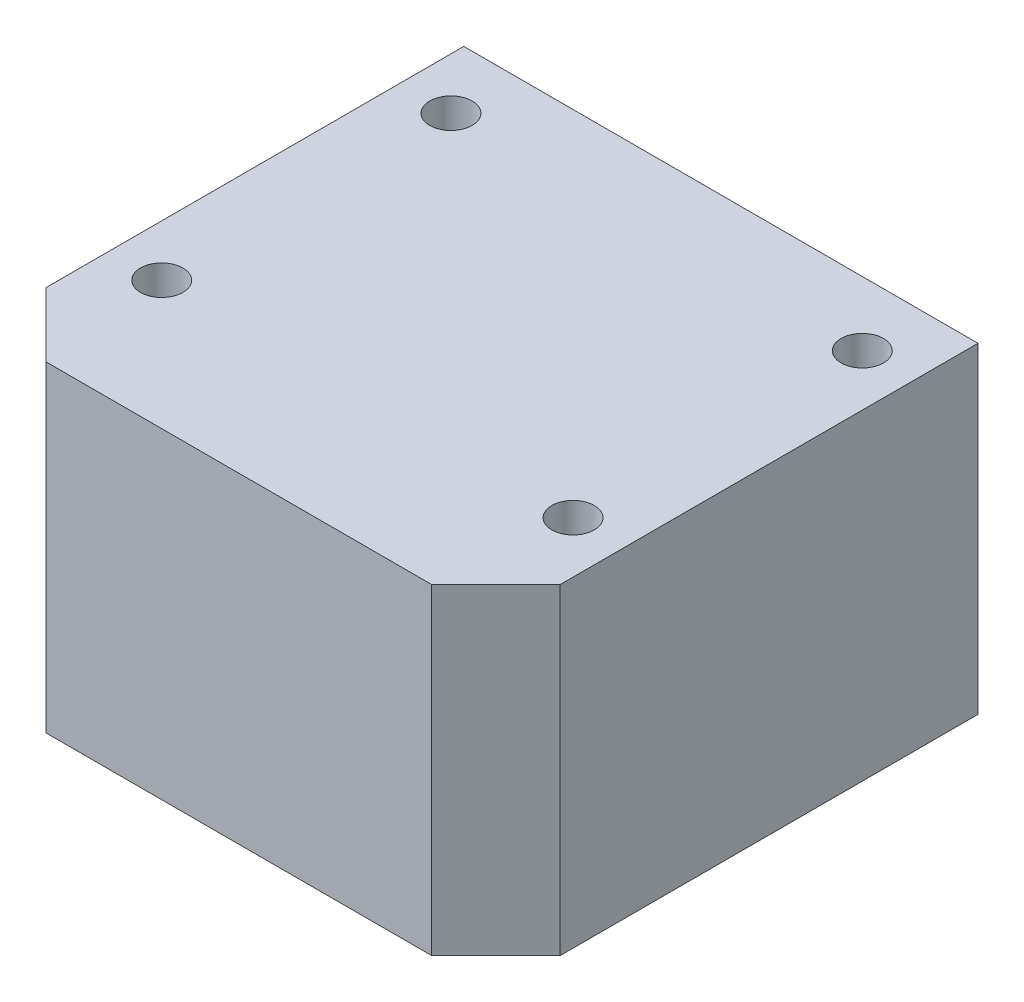
from build123d import *

# Parameters (mm, degrees)
SKETCH2_W             = 40
SKETCH2_H             = 32.5
BOSS_EXTRUDE1_DEPTH   = 25
SKETCH3_W             = 40
SKETCH3_H             = 5
BOSS_EXTRUDE2_DEPTH   = 25
SKETCH1_R             = 14
CUT_EXTRUDE1_DEPTH    = 9
CHAMFER1_SIZE         = 1
M4_TAPPED_HOLE2_D     = 3.3
M4_TAPPED_HOLE2_DEPTH = 10
M4_TAPPED_HOLE2_TIP   = 0.991420021
CHAMFER2_SIZE         = 5
M4_TAPPED_HOLE3_D     = 3.3
M4_TAPPED_HOLE3_DEPTH = 12.1
M4_TAPPED_HOLE3_TIP   = 0.991420021


with BuildPart() as part:
    # Sketch2 → Boss-Extrude1 (new body)
    with BuildSketch(Plane(origin=(0, 0, 0), x_dir=(1, 0, 0), z_dir=(0, 1, 0))):
        with Locations((0, 3.75)):
            Rectangle(SKETCH2_W, SKETCH2_H)
    extrude(amount=BOSS_EXTRUDE1_DEPTH)

    # Sketch3 → Boss-Extrude2 (add)
    with BuildSketch(Plane.XZ):
        with Locations((0, 15)):
            Rectangle(SKETCH3_W, SKETCH3_H)
    extrude(amount=-BOSS_EXTRUDE2_DEPTH)

    # Sketch1 → Cut-Extrude1 (cut)
    with BuildSketch(Plane(origin=(0, 0, 0), x_dir=(1, 0, 0), z_dir=(0, 1, 0))):
        with Locations(Location((0, 0, 0), (0, 0, 270))):
            Circle(SKETCH1_R)
    extrude(amount=CUT_EXTRUDE1_DEPTH, mode=Mode.SUBTRACT)

    # Chamfer1
    chamfer1_edges = [part.edges().sort_by_distance(p)[0] for p in [
        (0, 0, -14),
    ]]
    chamfer(chamfer1_edges, length=CHAMFER1_SIZE)

    # M4 Tapped Hole2
    with Locations(Plane(origin=(0, 0, -20), x_dir=(-1, 0, 0), z_dir=(0, 0, -1))):
        with Locations((0, 17)):
            Hole(M4_TAPPED_HOLE2_D / 2, depth=M4_TAPPED_HOLE2_DEPTH)
            with Locations((0, 0, -(M4_TAPPED_HOLE2_DEPTH + M4_TAPPED_HOLE2_TIP / 2))):  # 118° drill point
                Cone(0, M4_TAPPED_HOLE2_D / 2, M4_TAPPED_HOLE2_TIP, mode=Mode.SUBTRACT)

    # Chamfer2
    chamfer2_edges = [part.edges().sort_by_distance(p)[0] for p in [
        (20, 12.5, 17.5),
        (-20, 12.5, 17.5),
    ]]
    chamfer(chamfer2_edges, length=CHAMFER2_SIZE)

    # M4 Tapped Hole3
    with Locations(Plane(origin=(0, 25, 0), x_dir=(1, 0, 0), z_dir=(0, 1, 0))):
        with Locations((-16, 15), (-16, -7.5), (16, -7.5), (16, 15)):
            Hole(M4_TAPPED_HOLE3_D / 2, depth=M4_TAPPED_HOLE3_DEPTH)
            with Locations((0, 0, -(M4_TAPPED_HOLE3_DEPTH + M4_TAPPED_HOLE3_TIP / 2))):  # 118° drill point
                Cone(0, M4_TAPPED_HOLE3_D / 2, M4_TAPPED_HOLE3_TIP, mode=Mode.SUBTRACT)


solid = part.part
